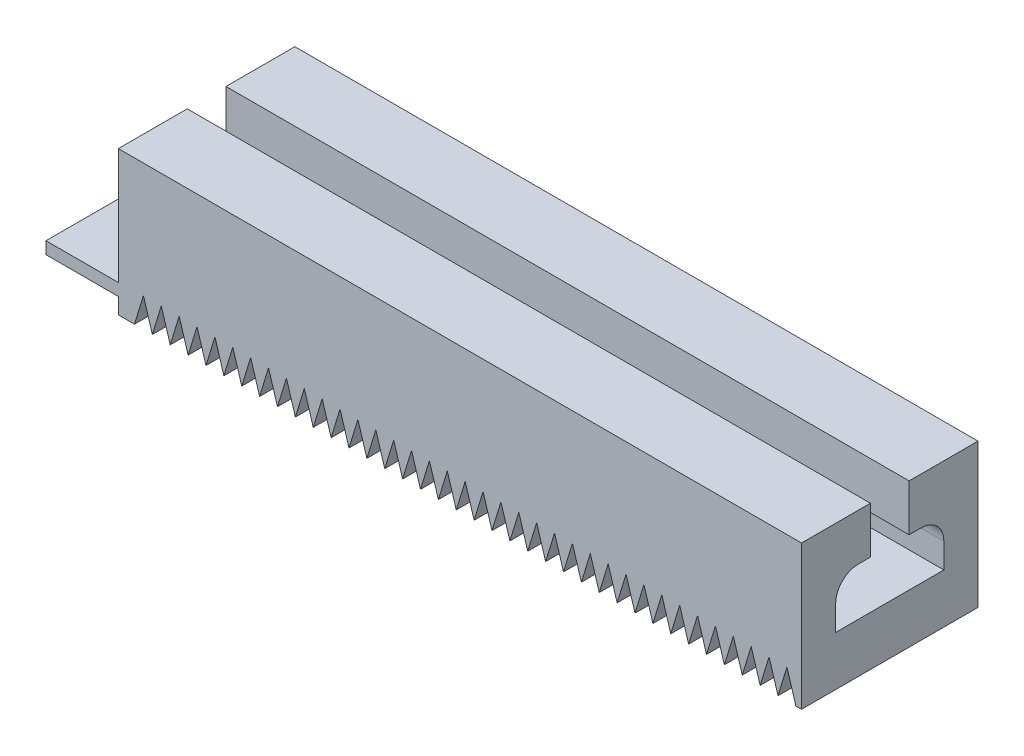
from build123d import *

# Parameters (mm, degrees)
BOSS_EXTRUDE1_DEPTH = 15.5
CUT_EXTRUDE1_DEPTH  = 81.5


with BuildPart() as part:
    # Sketch1 → Boss-Extrude1 (new body)
    with BuildSketch(Plane.XY):
        Polygon((-10.229681979, -19.726325088), (-70.229681979, -19.726325088), (-70.229681979, -29.913296732), (-76.585734932, -29.913296732), (-76.585734932, -30.976616664), (-70.229681979, -30.976616664), (-70.229681979, -32.376325088), (-68.814681979, -32.376325088), (-68.029681979, -29.801896387), (-67.244681979, -32.376325088), (-66.459681979, -29.801896387), (-65.674681979, -32.376325088), (-64.889681979, -29.801896387), (-64.104681979, -32.376325088), (-63.319681979, -29.801896387), (-62.534681979, -32.376325088), (-61.749681979, -29.801896387), (-60.964681979, -32.376325088), (-60.179681979, -29.801896387), (-59.394681979, -32.376325088), (-58.609681979, -29.801896387), (-57.824681979, -32.376325088), (-57.039681979, -29.801896387), (-56.254681979, -32.376325088), (-55.469681979, -29.801896387), (-54.684681979, -32.376325088), (-53.899681979, -29.801896387), (-53.114681979, -32.376325088), (-52.329681979, -29.801896387), (-51.544681979, -32.376325088), (-50.759681979, -29.801896387), (-49.974681979, -32.376325088), (-49.189681979, -29.801896387), (-48.404681979, -32.376325088), (-47.619681979, -29.801896387), (-46.834681979, -32.376325088), (-46.049681979, -29.801896387), (-45.264681979, -32.376325088), (-44.479681979, -29.801896387), (-43.694681979, -32.376325088), (-42.909681979, -29.801896387), (-42.124681979, -32.376325088), (-41.339681979, -29.801896387), (-40.554681979, -32.376325088), (-39.769681979, -29.801896387), (-38.984681979, -32.376325088), (-38.199681979, -29.801896387), (-37.414681979, -32.376325088), (-36.629681979, -29.801896387), (-35.844681979, -32.376325088), (-35.059681979, -29.801896387), (-34.274681979, -32.376325088), (-33.489681979, -29.801896387), (-32.704681979, -32.376325088), (-31.919681979, -29.801896387), (-31.134681979, -32.376325088), (-30.349681979, -29.801896387), (-29.564681979, -32.376325088), (-28.779681979, -29.801896387), (-27.994681979, -32.376325088), (-27.209681979, -29.801896387), (-26.424681979, -32.376325088), (-25.639681979, -29.801896387), (-24.854681979, -32.376325088), (-24.069681979, -29.801896387), (-23.284681979, -32.376325088), (-22.499681979, -29.801896387), (-21.714681979, -32.376325088), (-20.929681979, -29.801896387), (-20.144681979, -32.376325088), (-19.359681979, -29.801896387), (-18.574681979, -32.376325088), (-17.789681979, -29.801896387), (-17.004681979, -32.376325088), (-16.219681979, -29.801896387), (-15.434681979, -32.376325088), (-14.649681979, -29.801896387), (-13.864681979, -32.376325088), (-13.079681979, -29.801896387), (-12.294681979, -32.376325088), (-11.509681979, -29.801896387), (-10.724681979, -32.376325088), (-10.229681979, -32.376325088), align=None)
    extrude(amount=BOSS_EXTRUDE1_DEPTH)

    # Sketch2 → Cut-Extrude1 (cut)
    with BuildSketch(Plane.ZY.offset(70.229681979)):
        with BuildLine():
            Line((6.05, -23.826325088), (5, -23.826325088))
            ThreePointArc((5, -23.826325088), (3.585786438, -24.412111526), (3, -25.826325088))
            Line((3, -25.826325088), (3, -28.026325088))
            Line((3, -28.026325088), (12.5, -28.026325088))
            Line((12.5, -28.026325088), (12.5, -25.826325088))
            ThreePointArc((12.5, -25.826325088), (11.914213562, -24.412111526), (10.5, -23.826325088))
            Line((10.5, -23.826325088), (9.45, -23.826325088))
            Line((9.45, -23.826325088), (9.45, -19.726325088))
            Line((9.45, -19.726325088), (6.05, -19.726325088))
            Line((6.05, -19.726325088), (6.05, -23.826325088))
        make_face()
    extrude(amount=-CUT_EXTRUDE1_DEPTH, mode=Mode.SUBTRACT)


solid = part.part
